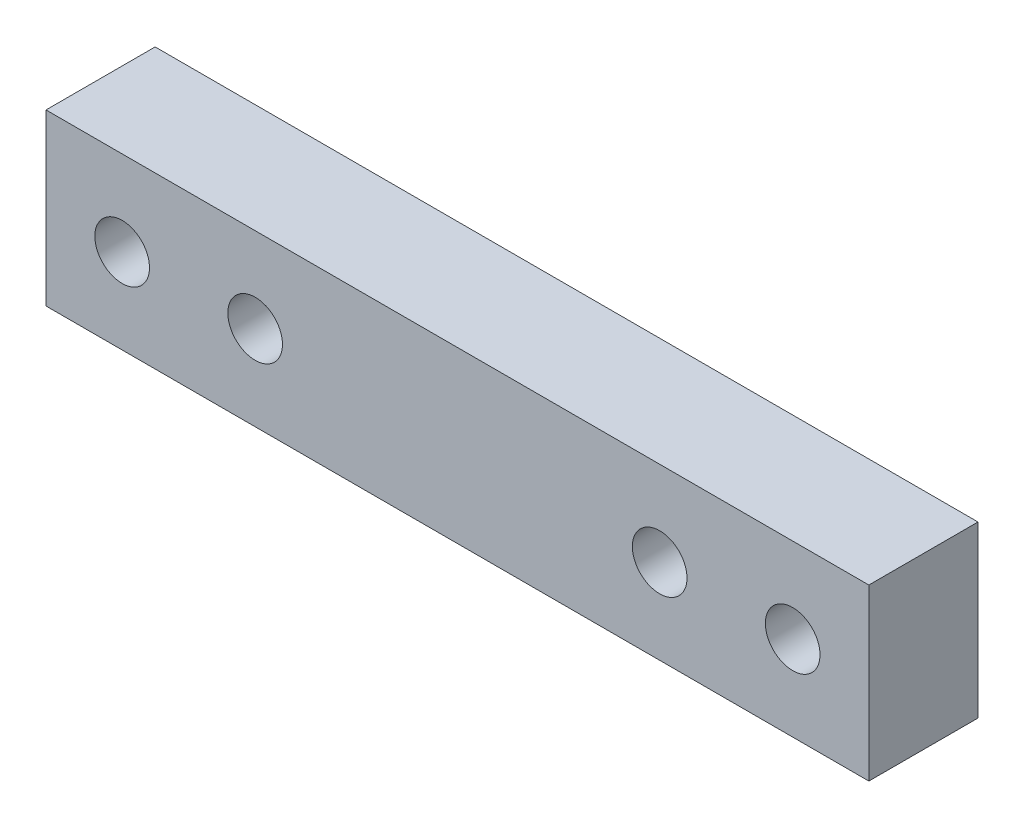
from build123d import *

# Parameters (mm, degrees)
CROQUIS1_W              = 45.16
CROQUIS1_H              = 9.32
CROQUIS1_R              = 1.5
SALIENTE_EXTRUIR1_DEPTH = 5.99


with BuildPart() as part:
    # Croquis1 → Saliente-Extruir1 (new body)
    with BuildSketch(Plane.XY):
        with Locations((22.58, 4.66)):
            Rectangle(CROQUIS1_W, CROQUIS1_H)
        with Locations(Location((4.18, 4.66, 0), (0, 0, 180))):
            Circle(CROQUIS1_R, mode=Mode.SUBTRACT)
        with Locations(Location((11.48, 4.66, 0), (0, 0, 180))):
            Circle(CROQUIS1_R, mode=Mode.SUBTRACT)
        with Locations(Location((40.98, 4.66, 0), (0, 0, 180))):
            Circle(CROQUIS1_R, mode=Mode.SUBTRACT)
        with Locations(Location((33.68, 4.66, 0), (0, 0, 180))):
            Circle(CROQUIS1_R, mode=Mode.SUBTRACT)
    extrude(amount=SALIENTE_EXTRUIR1_DEPTH)


solid = part.part
